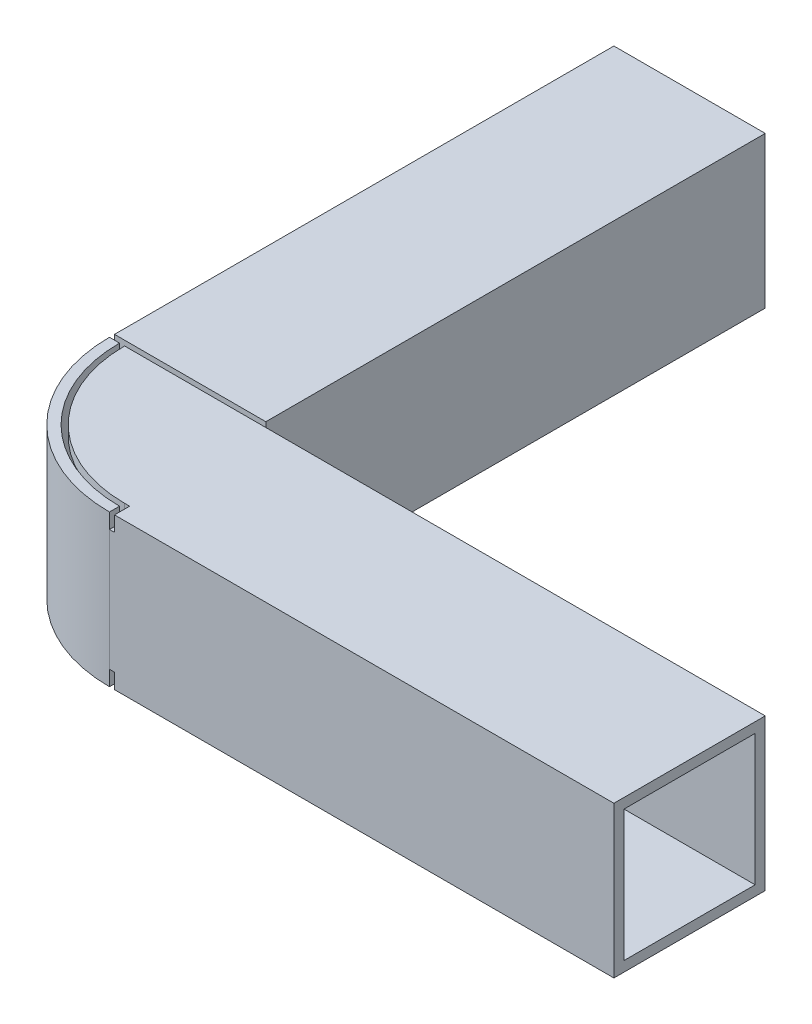
from build123d import *

# Parameters (mm, degrees)
EXTRUDE_1_DEPTH          = 15
FILLET_1_R               = 30
SHELL_1_T                = -2
CUT_EXTRUDE_1_DEPTH      = 145.568322948
CUT_EXTRUDE_1_DEPTH_BACK = 145.568322948
SKETCH_3_W               = 2
SKETCH_3_H               = 1
SKETCH_3_W_2             = 1
SKETCH_3_H_2             = 3
CUT_EXTRUDE_2_DEPTH      = 3


with BuildPart() as part:
    # 草图1 → 拉伸-薄壁1 (new, symmetric)
    with BuildSketch(Plane(origin=(0, 0, 0), x_dir=(1, 0, 0), z_dir=(0, 1, 0))):
        Polygon((0, 100), (0, 0), (100, 0), (100, -30), (-30, -30), (-30, 100), align=None)
    extrude(amount=EXTRUDE_1_DEPTH, both=True)

    # 圆角1
    fillet_1_edges = [part.edges().sort_by_distance(p)[0] for p in [
        (-30, 0, 30),
    ]]
    fillet(fillet_1_edges, radius=FILLET_1_R)

    # 抽壳1
    shell_1_openings = [part.faces().sort_by_distance(p)[0] for p in [
        (100, 0, 15),
        (-15, 0, -100),
    ]]
    offset(amount=SHELL_1_T, openings=shell_1_openings, kind=Kind.INTERSECTION)

    # 草图2 → 切除-拉伸1 (cut, two sides: drawn at the far end of the back side and taken through both)
    with BuildSketch(Plane(origin=(0, 15, 0), x_dir=(1, 0, 0), z_dir=(0, 1, 0)).offset(-CUT_EXTRUDE_1_DEPTH_BACK)):
        with BuildLine():
            ThreePointArc((-28, 0), (-19.798989873, -19.798989873), (0, -28))
            Line((0, -28), (0, -27))
            ThreePointArc((0, -27), (-19.091883092, -19.091883092), (-27, 0))
            Line((-27, 0), (0, 0))
            Line((0, 0), (0, 1))
            Line((0, 1), (-28, 1))
            Line((-28, 1), (-28, 0))
        make_face()
    extrude(amount=CUT_EXTRUDE_1_DEPTH + CUT_EXTRUDE_1_DEPTH_BACK, mode=Mode.SUBTRACT)

    # 草图3 → 切除-拉伸2 (cut)
    with BuildSketch(Plane(origin=(0, 15, 0), x_dir=(1, 0, 0), z_dir=(0, 1, 0))):
        with Locations((-29, 0.5)):
            Rectangle(SKETCH_3_W, SKETCH_3_H)
        with Locations((0.5, -28.5)):
            Rectangle(SKETCH_3_W_2, SKETCH_3_H_2)
    cut_extrude_2 = extrude(amount=-CUT_EXTRUDE_2_DEPTH, mode=Mode.SUBTRACT)

    # 镜向1: 切除-拉伸2 across plane
    add(cut_extrude_2.mirror(Plane.ZX), mode=Mode.SUBTRACT)


solid = part.part
